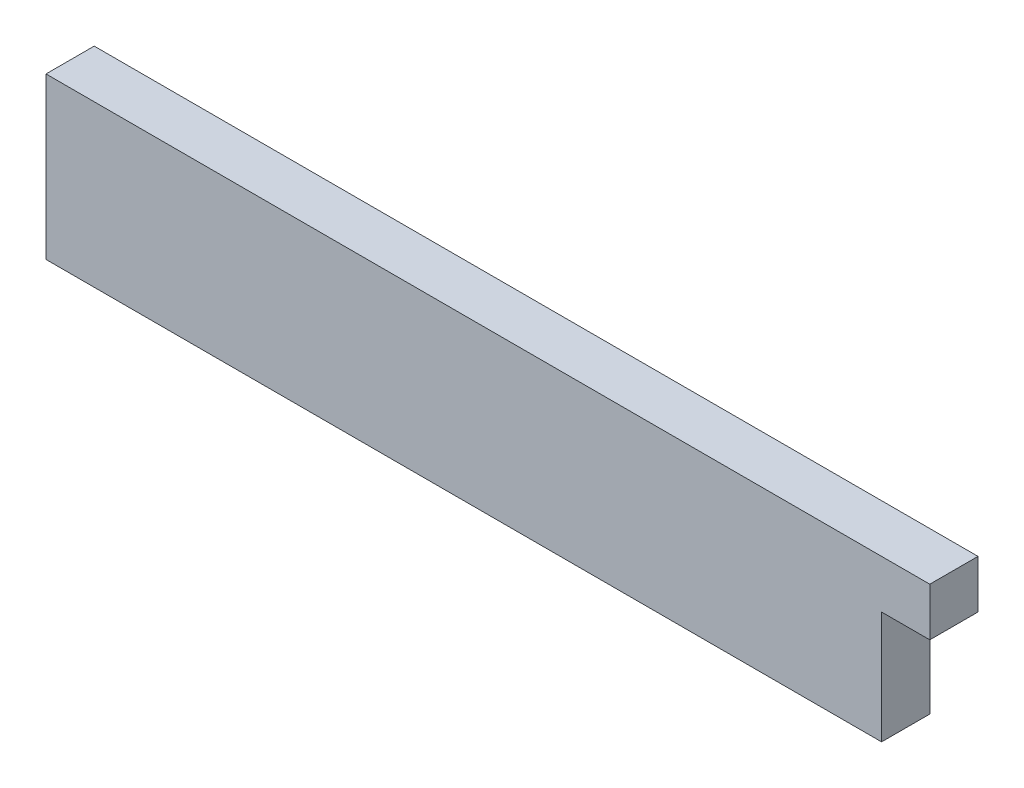
from build123d import *

# Parameters (mm, degrees)
BOSS_EXTRUDE1_DEPTH = 3


with BuildPart() as part:
    # Sketch1 → Boss-Extrude1 (new body)
    with BuildSketch(Plane.XY):
        Polygon((42, 10), (55, 10), (55, 7), (52, 7), (52, 0), (0, 0), (0, 10), align=None)
    extrude(amount=BOSS_EXTRUDE1_DEPTH)


solid = part.part
